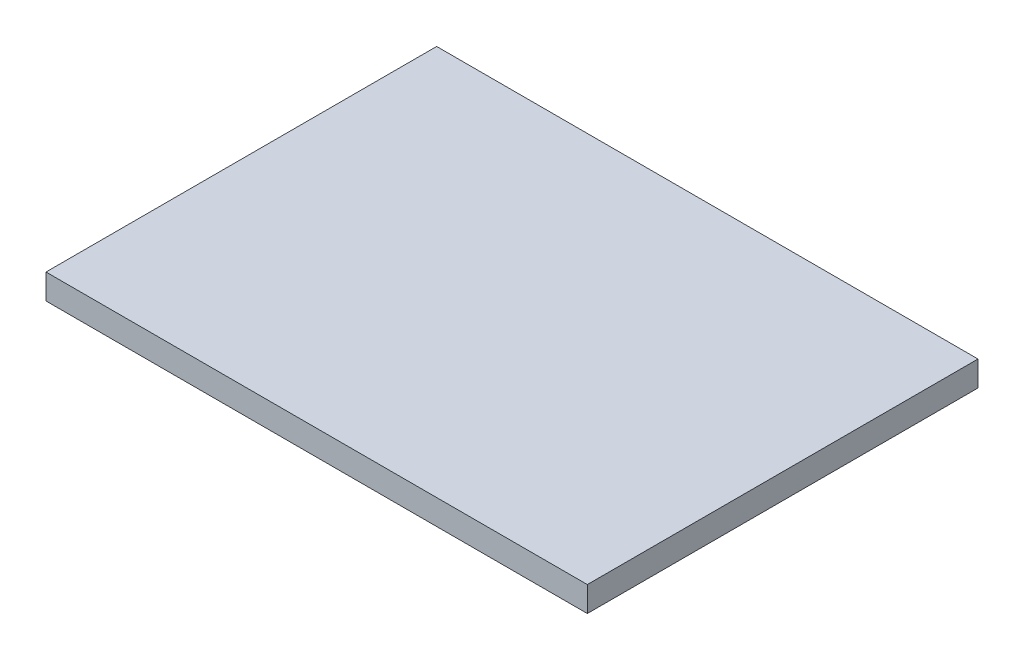
from build123d import *

# Parameters (mm, degrees)
SKETCH_1_W      = 388
SKETCH_1_H      = 280
EXTRUDE_1_DEPTH = 18


with BuildPart() as part:
    # 草图1 → 凸台-拉伸1 (new body)
    with BuildSketch(Plane(origin=(0, 0, 0), x_dir=(1, 0, 0), z_dir=(0, 1, 0))):
        with Locations((194, -140)):
            Rectangle(SKETCH_1_W, SKETCH_1_H)
    extrude(amount=EXTRUDE_1_DEPTH)


solid = part.part
